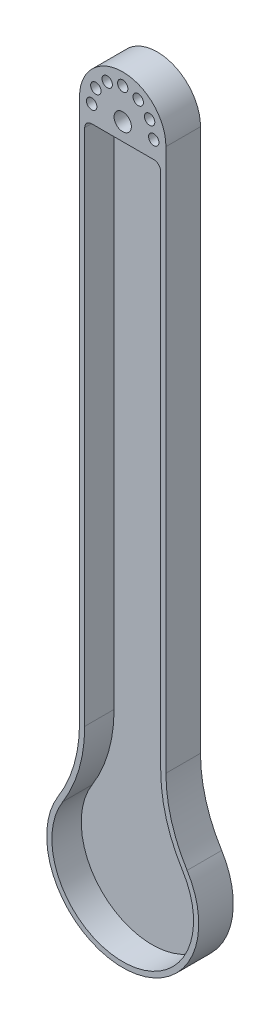
from build123d import *

# Parameters (mm, degrees)
BOSS_EXTRUDE1_DEPTH = 12.7
CUT_EXTRUDE1_DEPTH  = 10.795
SKETCH3_R           = 3.175
CUT_EXTRUDE2_DEPTH  = 23.622
SKETCH4_R           = 1.905
CUT_EXTRUDE3_DEPTH  = 7.62
SKETCH5_R           = 4.445
CUT_EXTRUDE4_DEPTH  = 1.27


with BuildPart() as part:
    # Sketch1 → Boss-Extrude1 (new body)
    with BuildSketch(Plane.XY):
        with BuildLine():
            Line((-15.875, 241.3), (-15.875, 41.885940063))
            ThreePointArc((-15.875, 41.885940063), (-17.859739298, 27.82498979), (-23.658870968, 14.862752926))
            ThreePointArc((-23.658870968, 14.862752926), (0, -27.94), (23.658870968, 14.862752926))
            ThreePointArc((23.658870968, 14.862752926), (17.859739298, 27.82498979), (15.875, 41.885940063))
            Line((15.875, 41.885940063), (15.875, 241.3))
            ThreePointArc((15.875, 241.3), (0, 257.175), (-15.875, 241.3))
        make_face()
    extrude(amount=BOSS_EXTRUDE1_DEPTH)

    # Sketch2 → Cut-Extrude1 (cut)
    with BuildSketch(Plane.XY.offset(12.7)):
        with BuildLine():
            Line((-11.43, 234.95), (11.43, 234.95))
            ThreePointArc((11.43, 234.95), (13.226051224, 234.206051224), (13.97, 232.41))
            Line((13.97, 232.41), (13.97, 41.885940063))
            ThreePointArc((13.97, 41.885940063), (16.029167022, 27.297704155), (22.045766129, 13.849383408))
            ThreePointArc((22.045766129, 13.849383408), (0, -26.035), (-22.045766129, 13.849383408))
            ThreePointArc((-22.045766129, 13.849383408), (-16.029167022, 27.297704155), (-13.97, 41.885940063))
            Line((-13.97, 41.885940063), (-13.97, 232.41))
            ThreePointArc((-13.97, 232.41), (-13.226051224, 234.206051224), (-11.43, 234.95))
        make_face()
    extrude(amount=-CUT_EXTRUDE1_DEPTH, mode=Mode.SUBTRACT)

    # Sketch3 → Cut-Extrude2 (cut)
    with BuildSketch(Plane.XY.offset(12.7)):
        with Locations((0, 241.3)):
            Circle(SKETCH3_R)
    extrude(amount=-CUT_EXTRUDE2_DEPTH, mode=Mode.SUBTRACT)

    # Sketch4 → Cut-Extrude3 (cut)
    with BuildSketch(Plane.XY.offset(12.7)):
        with Locations((-11.405580841, 241.3)):
            Circle(SKETCH4_R)
        with Locations((-9.877522754, 247.002790421)):
            Circle(SKETCH4_R)
        with Locations((-5.702790421, 251.177522754)):
            Circle(SKETCH4_R)
        with Locations((0, 252.705580841)):
            Circle(SKETCH4_R)
        with Locations((5.702790421, 251.177522754)):
            Circle(SKETCH4_R)
        with Locations((9.877522754, 247.002790421)):
            Circle(SKETCH4_R)
        with Locations((11.405580841, 241.3)):
            Circle(SKETCH4_R)
    extrude(amount=-CUT_EXTRUDE3_DEPTH, mode=Mode.SUBTRACT)

    # Sketch5 → Cut-Extrude4 (cut)
    with BuildSketch(Plane(origin=(0, 0, 0), x_dir=(-1, 0, 0), z_dir=(0, 0, -1))):
        with Locations((0, 241.3)):
            Circle(SKETCH5_R)
    extrude(amount=-CUT_EXTRUDE4_DEPTH, mode=Mode.SUBTRACT)


solid = part.part
